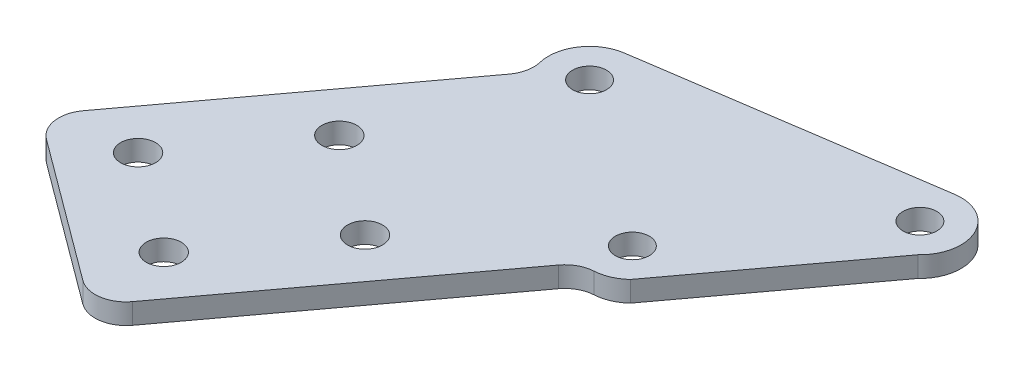
from build123d import *

# Parameters (mm, degrees)
SKETCH1_R           = 1.650000007
BOSS_EXTRUDE1_DEPTH = 1
SKETCH9_R           = 1.7
CUT_EXTRUDE3_DEPTH  = 2


with BuildPart() as part:
    # Sketch1 → Boss-Extrude1 (new, symmetric)
    with BuildSketch(Plane(origin=(0, 0, 0), x_dir=(1, 0, 0), z_dir=(0, 1, 0))):
        with BuildLine():
            Line((-3.163944782, -93.076388076), (-20.805834618, -116.891940565))
            ThreePointArc((-20.805834618, -116.891940565), (-21.362478255, -119.119545961), (-20.180929864, -121.088307332))
            Line((-20.180929864, -121.088307332), (-6.520660553, -131.207449705))
            ThreePointArc((-6.520660553, -131.207449705), (-4.293055157, -131.764093342), (-2.324293786, -130.582544951))
            Line((-2.324293786, -130.582544951), (15.317595998, -106.766992534))
            ThreePointArc((15.317595998, -106.766992534), (16.298016652, -105.915587831), (17.546382486, -105.558240139))
            ThreePointArc((17.546382486, -105.558240139), (18.880171652, -105.241928098), (20.028844772, -104.493865997))
            Line((20.028844772, -104.493865997), (31.933718152, -88.422960925))
            ThreePointArc((31.933718152, -88.422960925), (32.812947077, -83.759740105), (28.619624318, -81.538318002))
            Line((28.619624318, -81.538318002), (0.643845867, -85.704349694))
            ThreePointArc((0.643845867, -85.704349694), (-2.081865152, -87.422063847), (-2.657041002, -90.592113564))
            ThreePointArc((-2.657041002, -90.592113564), (-2.635147269, -91.890433717), (-3.163944782, -93.076388076))
        make_face()
        with Locations(Location((1.233011719, -89.660722224, 0), (0, 0, 90))):
            Circle(SKETCH1_R, mode=Mode.SUBTRACT)
        with Locations(Location((29.20879017, -85.494690532, 0), (0, 0, 90))):
            Circle(SKETCH1_R, mode=Mode.SUBTRACT)
        with Locations(Location((17.30391679, -101.565595604, 0), (0, 0, 90))):
            Circle(SKETCH1_R, mode=Mode.SUBTRACT)
    extrude(amount=BOSS_EXTRUDE1_DEPTH, both=True)

    # Sketch9 → Cut-Extrude3 (cut)
    with BuildSketch(Plane(origin=(0, 1, 0), x_dir=(1, 0, 0), z_dir=(0, 1, 0))):
        with Locations(Location((-6.267193351, -106.505511433, 0), (0, 0, 270))):
            Circle(SKETCH9_R)
        with Locations(Location((-14.600604716, -117.755144983, 0), (0, 0, 270))):
            Circle(SKETCH9_R)
        with Locations(Location((-4.958061673, -124.898069011, 0), (0, 0, 270))):
            Circle(SKETCH9_R)
        with Locations(Location((3.375349692, -113.648435461, 0), (0, 0, 270))):
            Circle(SKETCH9_R)
    extrude(amount=-CUT_EXTRUDE3_DEPTH, mode=Mode.SUBTRACT)


solid = part.part
